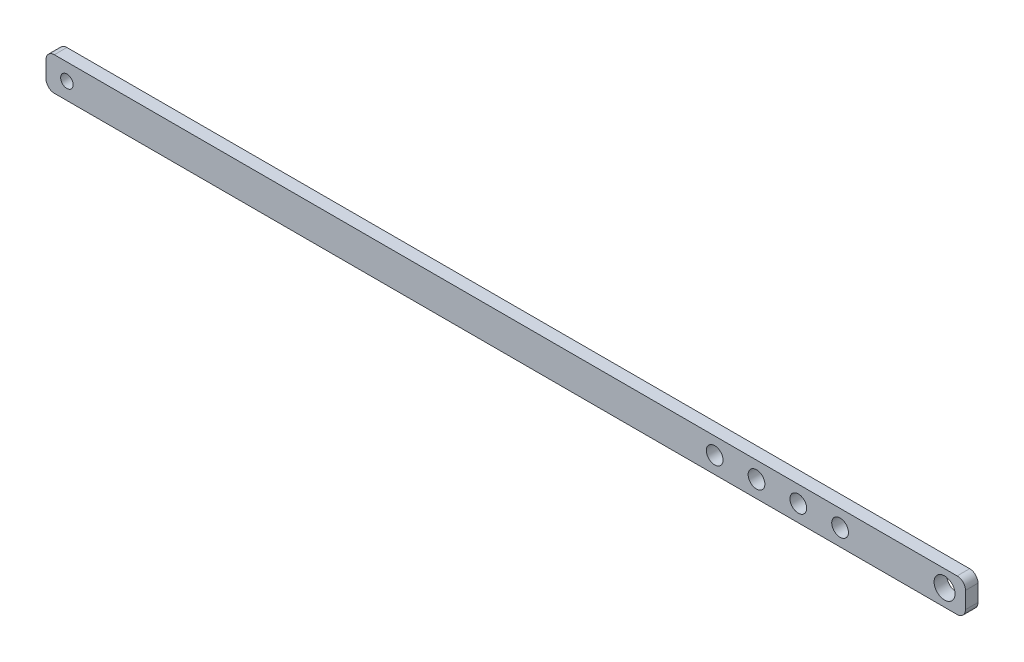
from build123d import *

# Parameters (mm, degrees)
SKETCH1_W           = 220
SKETCH1_H           = 8
BOSS_EXTRUDE1_DEPTH = 3
FILLET1_R           = 2
SKETCH2_R           = 1.5
CUT_EXTRUDE1_DEPTH  = 3
SKETCH3_R           = 2.5
CUT_EXTRUDE2_DEPTH  = 3
SKETCH4_R           = 2
CUT_EXTRUDE3_DEPTH  = 3
LPATTERN1_COUNT     = 4
LPATTERN1_PITCH     = 10


with BuildPart() as part:
    # Sketch1 → Boss-Extrude1 (new body)
    with BuildSketch(Plane.XY):
        Rectangle(SKETCH1_W, SKETCH1_H)
    extrude(amount=BOSS_EXTRUDE1_DEPTH)

    # Fillet1
    fillet1_edges = [part.edges().sort_by_distance(p)[0] for p in [
        (110, -4, 1.5),
        (-110, -4, 1.5),
        (-110, 4, 1.5),
        (110, 4, 1.5),
    ]]
    fillet(fillet1_edges, radius=FILLET1_R)

    # Sketch2 → Cut-Extrude1 (cut)
    with BuildSketch(Plane.XY.offset(3)):
        with Locations((-105, 0)):
            Circle(SKETCH2_R)
    extrude(amount=-CUT_EXTRUDE1_DEPTH, mode=Mode.SUBTRACT)

    # Sketch3 → Cut-Extrude2 (cut)
    with BuildSketch(Plane.XY.offset(3)):
        with Locations((105, 0)):
            Circle(SKETCH3_R)
    extrude(amount=-CUT_EXTRUDE2_DEPTH, mode=Mode.SUBTRACT)

    # Sketch4 → Cut-Extrude3 (cut)
    with BuildSketch(Plane.XY.offset(3)):
        with Locations((80, 0)):
            Circle(SKETCH4_R)
    cut_extrude3 = extrude(amount=-CUT_EXTRUDE3_DEPTH, mode=Mode.SUBTRACT)

    # LPattern1: Cut-Extrude3 ×4
    with Locations(*[(-i * LPATTERN1_PITCH, 0, 0) for i in range(1, LPATTERN1_COUNT)]):
        add(cut_extrude3, mode=Mode.SUBTRACT)


solid = part.part
